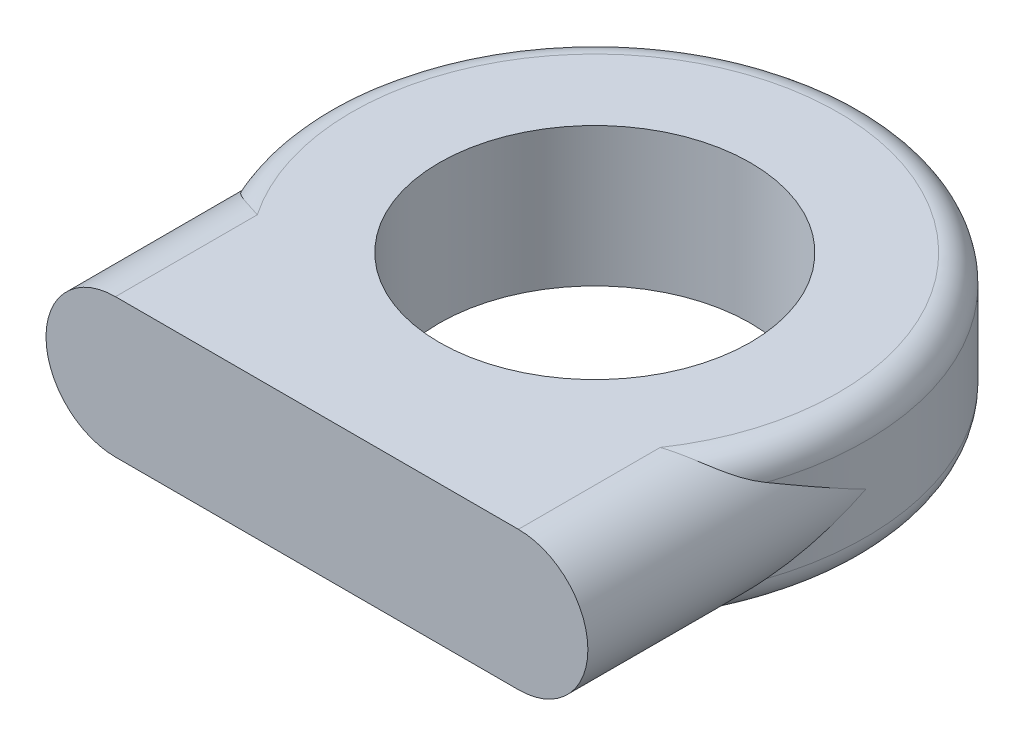
from build123d import *

# Parameters (mm, degrees)
EXTRUDE_1_DEPTH     = 10
SKETCH_2_R          = 9.75
EXTRUDE_2_DEPTH     = 5
FILLET_2_R          = 1
SKETCH_3_R          = 5.6
CUT_EXTRUDE_1_DEPTH = 5


with BuildPart() as part:
    # 草图1 → 凸台-拉伸1 (new body)
    with BuildSketch(Plane.XY):
        with BuildLine():
            Line((-7.25, 2.4999999999999996), (7.249999999999998, 2.500000000000002))
            ThreePointArc((7.249999999999998, 2.500000000000002), (9.75, 4.33e-15), (7.250000000000002, -2.499999999999997))
            Line((7.250000000000002, -2.499999999999997), (-7.25, -2.4999999999999996))
            ThreePointArc((-7.25, -2.4999999999999996), (-9.75, 3.1e-16), (-7.25, 2.4999999999999996))
        make_face()
    extrude(amount=EXTRUDE_1_DEPTH)

    # 草图2 → 凸台-拉伸2 (add)
    with BuildSketch(Plane(origin=(-4.5e-16, 2.500000000000001, 0), x_dir=(1, 1.7e-16, 0), z_dir=(-1.7e-16, 1, 0))):
        Circle(SKETCH_2_R)
    extrude(amount=-EXTRUDE_2_DEPTH)

    # 圆角2
    fillet_2_edges = [part.edges().sort_by_distance(p)[0] for p in [
        (8.387e-14, -2.499999999999999, -9.75),
        (8.304e-14, 2.500000000000001, -9.75),
    ]]
    fillet(fillet_2_edges, radius=FILLET_2_R)

    # 草图3 → 切除-拉伸1 (cut)
    with BuildSketch(Plane(origin=(-4.5e-16, 2.500000000000001, 0), x_dir=(1, 1.7e-16, 0), z_dir=(-1.7e-16, 1, 0))):
        with Locations(Location((0, 0, 0), (0, 0, 180))):
            Circle(SKETCH_3_R)
    extrude(amount=-CUT_EXTRUDE_1_DEPTH, mode=Mode.SUBTRACT)


solid = part.part
